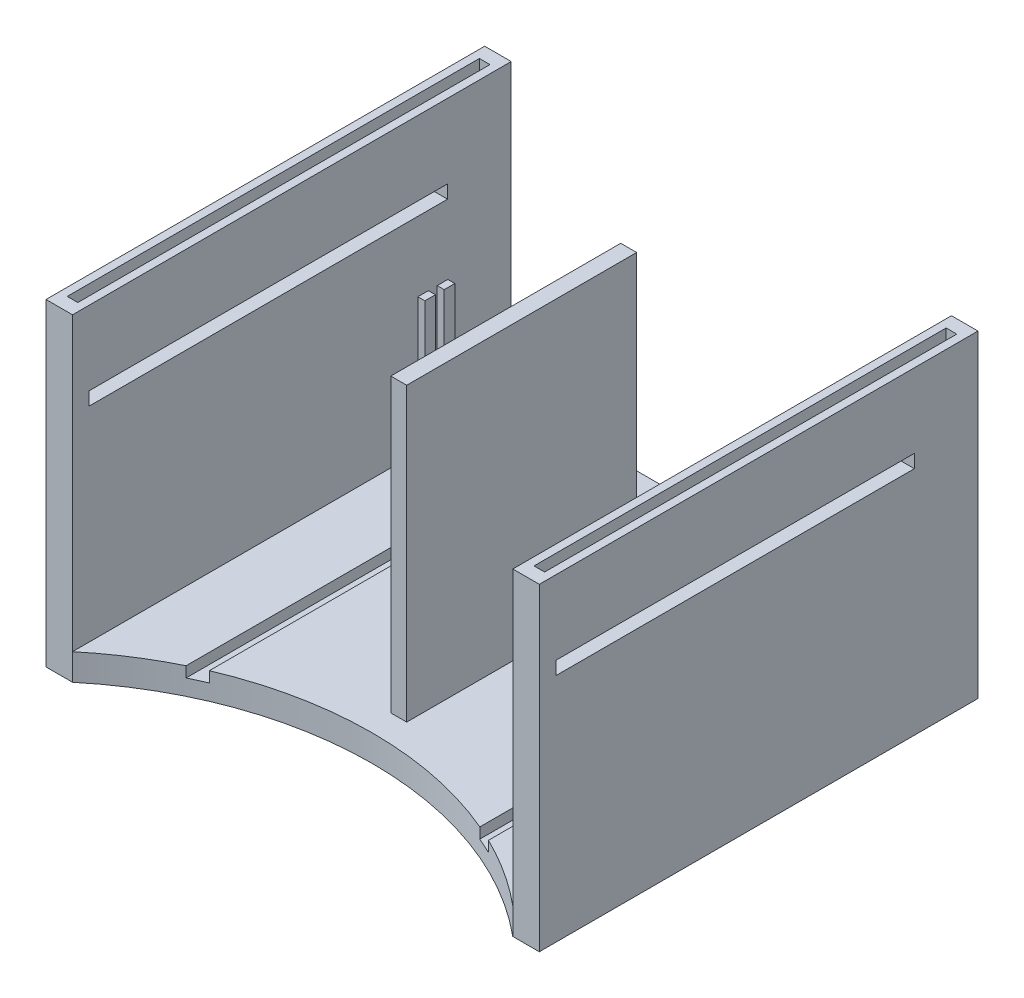
from build123d import *

# Parameters (mm, degrees)
EXTRUDE_THIN2_DEPTH     = 165.4
SKETCH11_W              = 163
SKETCH11_H              = 4
BOSS_EXTRUDE3_DEPTH     = 2.6416
CUT_EXTRUDE6_DEPTH      = 270.69086006
CUT_EXTRUDE6_DEPTH_BACK = 270.69086006
SKETCH13_W              = 135.195011338
SKETCH13_H              = 5
CUT_EXTRUDE7_DEPTH      = 273.127102656
SKETCH19_W              = 4
SKETCH19_H              = 155.4
CUT_EXTRUDE9_DEPTH      = 10
SKETCH20_W              = 4
SKETCH20_H              = 155.4
CUT_EXTRUDE10_DEPTH     = 10
SKETCH21_W              = 6
SKETCH21_H              = 86.697
BOSS_EXTRUDE4_DEPTH     = 110
CUT_EXTRUDE11_DEPTH     = 4
SKETCH23_W              = 163
SKETCH23_H              = 4
BOSS_EXTRUDE5_DEPTH     = 2.6416
SKETCH24_W              = 2.6416
SKETCH24_H              = 4
BOSS_EXTRUDE6_DEPTH     = 49.6416
SKETCH25_W              = 2.64
SKETCH25_H              = 4
BOSS_EXTRUDE7_DEPTH     = 49.6416
SKETCH26_W              = 2.64
SKETCH26_H              = 4
BOSS_EXTRUDE8_DEPTH     = 49.6416


with BuildPart() as part:
    # Sketch2 → Extrude-Thin2 (new body)
    with BuildSketch(Plane.XY):
        Polygon((0, 120), (0, 0), (186, 0), (186, 120), (176, 120), (176, 10), (10, 10), (10, 120), align=None)
    extrude(amount=EXTRUDE_THIN2_DEPTH)

    # Sketch11 → Boss-Extrude3 (add)
    with BuildSketch(Plane(origin=(0, 10, 0), x_dir=(1, 0, 0), z_dir=(0, 1, 0))):
        with Locations((93, -34.703)):
            Rectangle(SKETCH11_W, SKETCH11_H)
    extrude(amount=BOSS_EXTRUDE3_DEPTH)

    # Sketch13 → Cut-Extrude6 (cut, two sides: drawn at the far end of the back side and taken through both)
    with BuildSketch(Plane(origin=(10, 0, 0), x_dir=(0, 0, -1), z_dir=(1, 0, 0)).offset(-CUT_EXTRUDE6_DEPTH_BACK)):
        with Locations((-91.597505669, 89.551599899)):
            Rectangle(SKETCH13_W, SKETCH13_H)
    extrude(amount=CUT_EXTRUDE6_DEPTH + CUT_EXTRUDE6_DEPTH_BACK, mode=Mode.SUBTRACT)

    # Sketch14 → Cut-Extrude7 (cut, through all)
    with BuildSketch(Plane(origin=(0, 10, 0), x_dir=(1, 0, 0), z_dir=(0, 1, 0))):
        with BuildLine():
            Line((176, -165.4), (10, -165.4))
            ThreePointArc((10, -165.4), (93, -135.4), (176, -165.4))
        make_face()
    extrude(amount=-CUT_EXTRUDE7_DEPTH, mode=Mode.SUBTRACT)

    # Sketch19 → Cut-Extrude9 (cut)
    with BuildSketch(Plane(origin=(0, 120, 0), x_dir=(1, 0, 0), z_dir=(0, 1, 0))):
        with Locations((5, -82.7)):
            Rectangle(SKETCH19_W, SKETCH19_H)
    extrude(amount=-CUT_EXTRUDE9_DEPTH, mode=Mode.SUBTRACT)

    # Sketch20 → Cut-Extrude10 (cut)
    with BuildSketch(Plane(origin=(0, 120, 0), x_dir=(1, 0, 0), z_dir=(0, 1, 0))):
        with Locations((181, -82.7)):
            Rectangle(SKETCH20_W, SKETCH20_H)
    extrude(amount=-CUT_EXTRUDE10_DEPTH, mode=Mode.SUBTRACT)

    # Sketch21 → Boss-Extrude4 (add, through all)
    with BuildSketch(Plane(origin=(0, 10, 0), x_dir=(1, 0, 0), z_dir=(0, 1, 0))):
        with Locations((93, -82.0515)):
            Rectangle(SKETCH21_W, SKETCH21_H)
    extrude(amount=BOSS_EXTRUDE4_DEPTH)

    # Sketch22 → Cut-Extrude11 (cut)
    with BuildSketch(Plane(origin=(0, 10, 0), x_dir=(1, 0, 0), z_dir=(0, 1, 0))):
        Polygon((36, -51.703), (36, -148.583194008), (42, -145.837577441), (42, -51.703), align=None)
        Polygon((144, -145.837577441), (150, -148.583194008), (150, -51.703), (144, -51.703), align=None)
    extrude(amount=-CUT_EXTRUDE11_DEPTH, mode=Mode.SUBTRACT)

    # Sketch23 → Boss-Extrude5 (add)
    with BuildSketch(Plane(origin=(0, 10, 0), x_dir=(1, 0, 0), z_dir=(0, 1, 0))):
        with Locations((93, -27.4)):
            Rectangle(SKETCH23_W, SKETCH23_H)
    extrude(amount=BOSS_EXTRUDE5_DEPTH)

    # Sketch24 → Boss-Extrude6 (add)
    with BuildSketch(Plane(origin=(0, 12.6416, 0), x_dir=(1, 0, 0), z_dir=(0, 1, 0))):
        with Locations((12.8208, -34.703)):
            Rectangle(SKETCH24_W, SKETCH24_H)
    extrude(amount=BOSS_EXTRUDE6_DEPTH)

    # Sketch25 → Boss-Extrude7 (add)
    with BuildSketch(Plane(origin=(0, 12.6416, 0), x_dir=(1, 0, 0), z_dir=(0, 1, 0))):
        with Locations((12.82, -27.4)):
            Rectangle(SKETCH25_W, SKETCH25_H)
    extrude(amount=BOSS_EXTRUDE7_DEPTH)

    # Sketch26 → Boss-Extrude8 (add)
    with BuildSketch(Plane(origin=(0, 12.6416, 0), x_dir=(1, 0, 0), z_dir=(0, 1, 0))):
        with Locations((173.18, -34.703)):
            Rectangle(SKETCH26_W, SKETCH26_H)
        with Locations((173.18, -27.4)):
            Rectangle(SKETCH26_W, SKETCH26_H)
    extrude(amount=BOSS_EXTRUDE8_DEPTH)


solid = part.part
